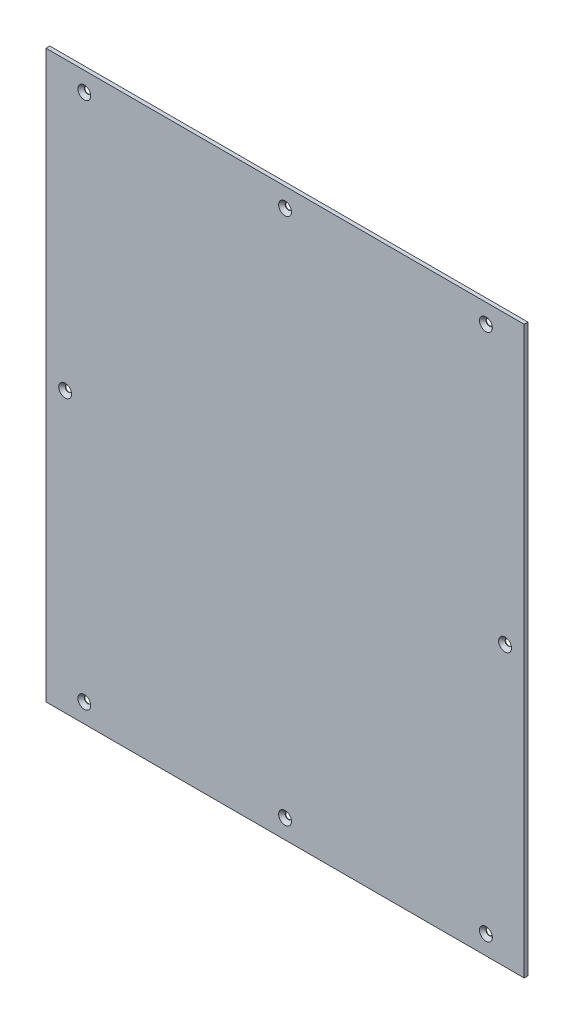
from build123d import *

# Parameters (mm, degrees)
SKETCH1_W                                    = 500
SKETCH1_H                                    = 592
BOSS_EXTRUDE1_DEPTH                          = 4
CSK_FOR_M6_HEX_SOCKET_COUNTERSUNK_CA_2_COUNT = 2
CSK_FOR_M6_HEX_SOCKET_COUNTERSUNK_CA_2_PITCH = 460
CSK_FOR_M6_HEX_SOCKET_COUNTERSUNK_CA_3_COUNT = 2
CSK_FOR_M6_HEX_SOCKET_COUNTERSUNK_CA_3_PITCH = 272.73430294
CSK_FOR_M6_HEX_SOCKET_COUNTERSUNK_CA_4_COUNT = 2
CSK_FOR_M6_HEX_SOCKET_COUNTERSUNK_CA_4_PITCH = 356.207804519
CSK_FOR_M6_HEX_SOCKET_COUNTERSUNK_CA_5_COUNT = 2
CSK_FOR_M6_HEX_SOCKET_COUNTERSUNK_CA_5_PITCH = 517.28522113
CSK_FOR_M6_HEX_SOCKET_COUNTERSUNK_CA_6_COUNT = 2
CSK_FOR_M6_HEX_SOCKET_COUNTERSUNK_CA_6_PITCH = 521.536192416
CSK_FOR_M6_HEX_SOCKET_COUNTERSUNK_CA_7_COUNT = 2
CSK_FOR_M6_HEX_SOCKET_COUNTERSUNK_CA_7_PITCH = 362.35341864
CSK_FOR_M6_HEX_SOCKET_COUNTERSUNK_CA_8_COUNT = 2
CSK_FOR_M6_HEX_SOCKET_COUNTERSUNK_CA_8_PITCH = 280.713376952


with BuildPart() as part:
    # Sketch1 → Boss-Extrude1 (new body)
    with BuildSketch(Plane.XY):
        Rectangle(SKETCH1_W, SKETCH1_H)
    extrude(amount=BOSS_EXTRUDE1_DEPTH)

    # Sketch4 → CSK for M6 Hex Socket Countersunk Cap Screw1 (revolve, cut)
    with BuildSketch(Plane(origin=(-230, -4, 4), x_dir=(0, -1, 0), z_dir=(1, 0, 0))):
        Polygon((0, 0), (0, 4), (3.3, 4), (3.3, 3.42), (6.72, 0), align=None)
    csk_for_m6_hex_socket_countersunk_cap_sc = revolve(axis=Axis((-230, -4, 10.35), (0, 0, -1)), mode=Mode.SUBTRACT)

    # CSK for M6 Hex Socket Countersunk Ca 2: CSK for M6 Hex Socket Countersunk Cap Screw1 ×2
    with Locations(*[(i * CSK_FOR_M6_HEX_SOCKET_COUNTERSUNK_CA_2_PITCH, 0, 0) for i in range(1, CSK_FOR_M6_HEX_SOCKET_COUNTERSUNK_CA_2_COUNT)]):
        add(csk_for_m6_hex_socket_countersunk_cap_sc, mode=Mode.SUBTRACT)

    # CSK for M6 Hex Socket Countersunk Ca 3: CSK for M6 Hex Socket Countersunk Cap Screw1 ×2
    with Locations(*[Vector(0.07333144303605385, -0.9973076252903365, 0) * (i * CSK_FOR_M6_HEX_SOCKET_COUNTERSUNK_CA_3_PITCH) for i in range(1, CSK_FOR_M6_HEX_SOCKET_COUNTERSUNK_CA_3_COUNT)]):
        add(csk_for_m6_hex_socket_countersunk_cap_sc, mode=Mode.SUBTRACT)

    # CSK for M6 Hex Socket Countersunk Ca 4: CSK for M6 Hex Socket Countersunk Cap Screw1 ×2
    with Locations(*[Vector(0.6456905129038378, -0.7635992152601906, 0) * (i * CSK_FOR_M6_HEX_SOCKET_COUNTERSUNK_CA_4_PITCH) for i in range(1, CSK_FOR_M6_HEX_SOCKET_COUNTERSUNK_CA_4_COUNT)]):
        add(csk_for_m6_hex_socket_countersunk_cap_sc, mode=Mode.SUBTRACT)

    # CSK for M6 Hex Socket Countersunk Ca 5: CSK for M6 Hex Socket Countersunk Cap Screw1 ×2
    with Locations(*[Vector(0.8505945695460384, -0.525822097537551, 0) * (i * CSK_FOR_M6_HEX_SOCKET_COUNTERSUNK_CA_5_PITCH) for i in range(1, CSK_FOR_M6_HEX_SOCKET_COUNTERSUNK_CA_5_COUNT)]):
        add(csk_for_m6_hex_socket_countersunk_cap_sc, mode=Mode.SUBTRACT)

    # CSK for M6 Hex Socket Countersunk Ca 6: CSK for M6 Hex Socket Countersunk Cap Screw1 ×2
    with Locations(*[Vector(0.8436614877321075, 0.5368754921931593, 0) * (i * CSK_FOR_M6_HEX_SOCKET_COUNTERSUNK_CA_6_PITCH) for i in range(1, CSK_FOR_M6_HEX_SOCKET_COUNTERSUNK_CA_6_COUNT)]):
        add(csk_for_m6_hex_socket_countersunk_cap_sc, mode=Mode.SUBTRACT)

    # CSK for M6 Hex Socket Countersunk Ca 7: CSK for M6 Hex Socket Countersunk Cap Screw1 ×2
    with Locations(*[Vector(0.6347394233600139, 0.7727262545252344, 0) * (i * CSK_FOR_M6_HEX_SOCKET_COUNTERSUNK_CA_7_PITCH) for i in range(1, CSK_FOR_M6_HEX_SOCKET_COUNTERSUNK_CA_7_COUNT)]):
        add(csk_for_m6_hex_socket_countersunk_cap_sc, mode=Mode.SUBTRACT)

    # CSK for M6 Hex Socket Countersunk Ca 8: CSK for M6 Hex Socket Countersunk Cap Screw1 ×2
    with Locations(*[Vector(0.07124704998790936, 0.9974586998307351, 0) * (i * CSK_FOR_M6_HEX_SOCKET_COUNTERSUNK_CA_8_PITCH) for i in range(1, CSK_FOR_M6_HEX_SOCKET_COUNTERSUNK_CA_8_COUNT)]):
        add(csk_for_m6_hex_socket_countersunk_cap_sc, mode=Mode.SUBTRACT)


solid = part.part
